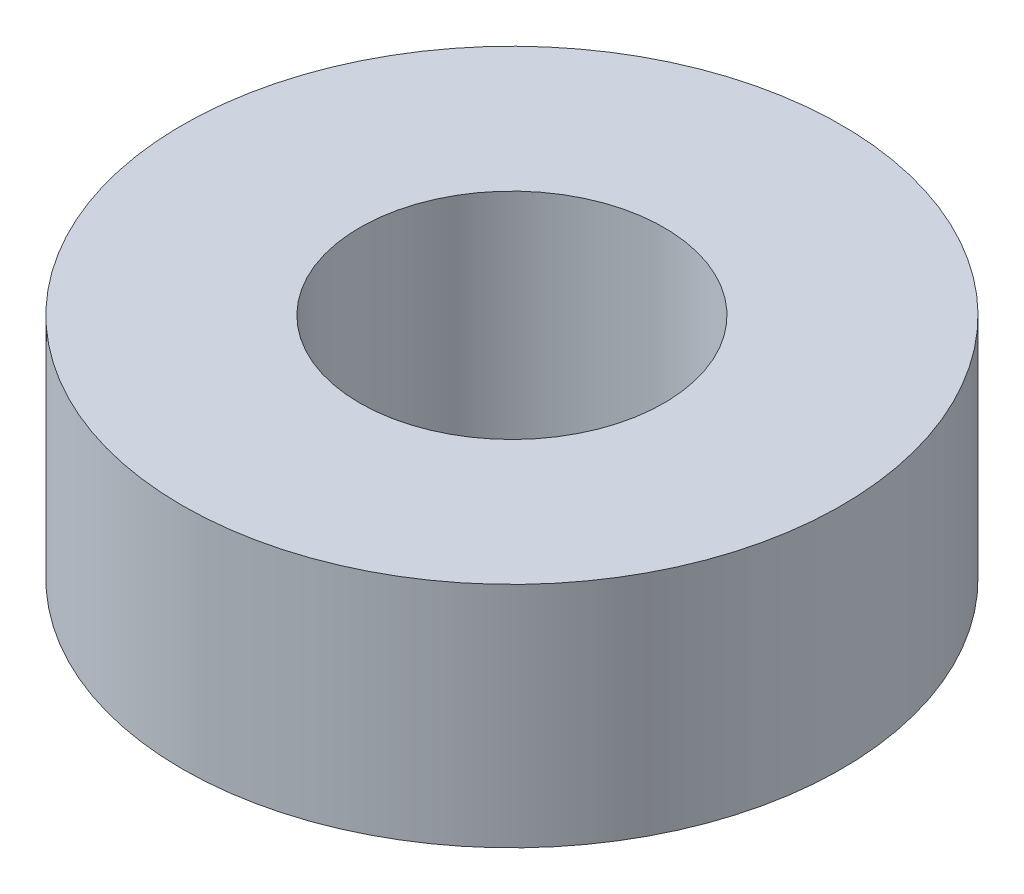
from build123d import *

# Parameters (mm, degrees)
SKETCH1_R           = 13
SKETCH1_R_2         = 6
BOSS_EXTRUDE1_DEPTH = 9


with BuildPart() as part:
    # Sketch1 → Boss-Extrude1 (new body)
    with BuildSketch(Plane(origin=(0, 0, 0), x_dir=(1, 0, 0), z_dir=(0, 1, 0))):
        with Locations(Location((0, 0, 0), (0, 0, 270))):
            Circle(SKETCH1_R)
        with Locations(Location((0, 0, 0), (0, 0, 270))):
            Circle(SKETCH1_R_2, mode=Mode.SUBTRACT)
    extrude(amount=BOSS_EXTRUDE1_DEPTH)


solid = part.part
